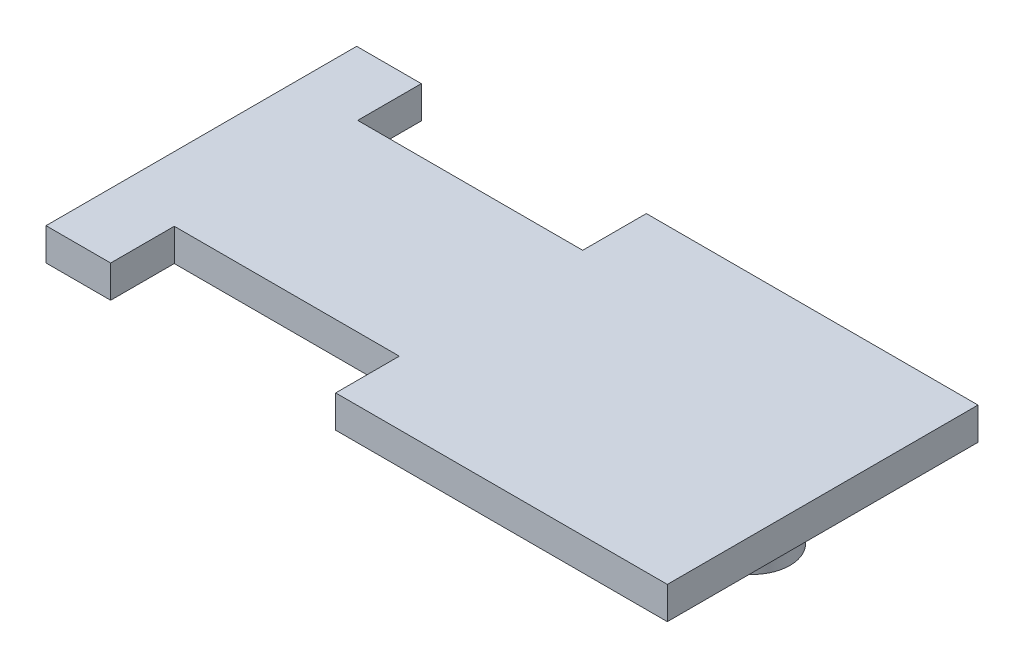
from build123d import *

# Parameters (mm, degrees)
SKETCH1_W           = 101.6
SKETCH1_H           = 50.8
BOSS_EXTRUDE1_DEPTH = 10
SKETCH3_W           = 36.795970914
SKETCH3_H           = 10.40575266
SKETCH3_H_2         = 15.093919488
CUT_EXTRUDE4_DEPTH  = 10
BOSS_EXTRUDE3_DEPTH = 7.412460188
SKETCH8_W           = 111.985504673
SKETCH8_H           = 56.913410447
CUT_EXTRUDE5_DEPTH  = 4.716


with BuildPart() as part:
    # Sketch1 → Boss-Extrude1 (new body)
    with BuildSketch(Plane(origin=(0, 0, 0), x_dir=(1, 0, 0), z_dir=(0, 1, 0))):
        with Locations((-52.916666667, 30.294791667)):
            Rectangle(SKETCH1_W, SKETCH1_H)
    extrude(amount=BOSS_EXTRUDE1_DEPTH)

    # Sketch3 → Cut-Extrude4 (cut)
    with BuildSketch(Plane(origin=(0, 10, 0), x_dir=(1, 0, 0), z_dir=(0, 1, 0))):
        with Locations((-74.746447121, 10.097667997)):
            Rectangle(SKETCH3_W, SKETCH3_H)
        with Locations((-74.746447121, 52.83599875)):
            Rectangle(SKETCH3_W, SKETCH3_H_2)
    extrude(amount=-CUT_EXTRUDE4_DEPTH, mode=Mode.SUBTRACT)

    # Sketch5 → Boss-Extrude3 (add)
    with BuildSketch(Plane.XZ):
        with BuildLine():
            ThreePointArc((-19.801479391, -30.294791667), (-13.631556544, -36.464714513), (-7.461633698, -30.294791667))
            Line((-7.461633698, -30.294791667), (-19.801479391, -30.294791667))
        make_face()
        with BuildLine():
            Line((-19.801479391, -30.294791667), (-7.461633698, -30.294791667))
            ThreePointArc((-7.461633698, -30.294791667), (-13.631556544, -24.12486882), (-19.801479391, -30.294791667))
        make_face()
    extrude(amount=BOSS_EXTRUDE3_DEPTH)

    # Sketch7 → Revolve3 (revolve)
    with BuildSketch(Plane.XZ.offset(7.412460188)):
        with BuildLine():
            Line((-15.363131646, -27.535093848), (-11.467087667, -33.379159817))
            ThreePointArc((-11.467087667, -33.379159817), (-10.493076672, -28.509104843), (-15.363131646, -27.535093848))
        make_face()
    revolve(axis=Axis((-15.363131646, -7.412460188, -27.535093848), (0.5547001962252264, 0, -0.8320502943378455)))

    # Sketch8 → Cut-Extrude5 (cut)
    with BuildSketch(Plane(origin=(0, 10, 0), x_dir=(1, 0, 0), z_dir=(0, 1, 0))):
        with Locations((-50.660840015, 30.234288396)):
            Rectangle(SKETCH8_W, SKETCH8_H)
    extrude(amount=-CUT_EXTRUDE5_DEPTH, mode=Mode.SUBTRACT)


solid = part.part
